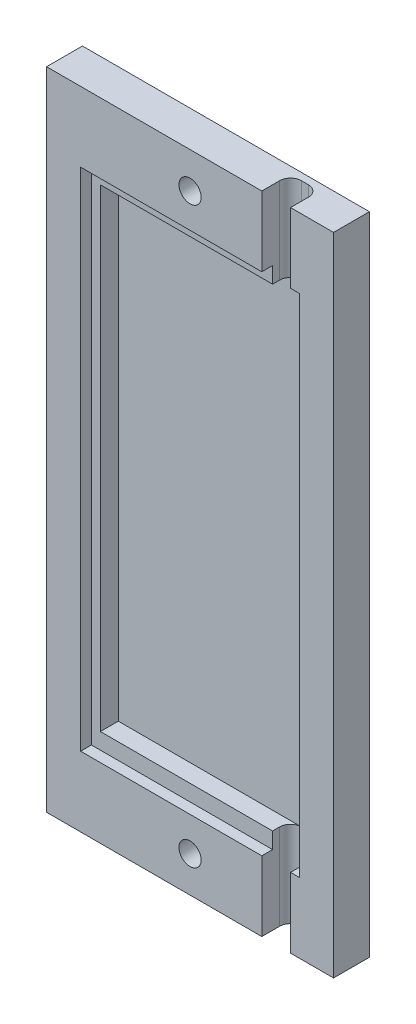
from build123d import *

# Parameters (mm, degrees)
SKETCH1_W           = 90
SKETCH1_H           = 40
BOSS_EXTRUDE1_DEPTH = 5
SKETCH2_W           = 30.5
SKETCH2_H           = 70.5
CUT_EXTRUDE1_DEPTH  = 1.5
SKETCH3_W           = 28
SKETCH3_H           = 66
CUT_EXTRUDE2_DEPTH  = 2.5
SKETCH4_W           = 4
SKETCH4_H           = 4
CUT_EXTRUDE3_DEPTH  = 99.615414617
FILLET1_R           = 1.5
SKETCH6_R           = 1.55
CUT_EXTRUDE5_DEPTH  = 4.5
SKETCH7_R           = 1.55
CUT_EXTRUDE6_DEPTH  = 4.5


with BuildPart() as part:
    # Sketch1 → Boss-Extrude1 (new body)
    with BuildSketch(Plane(origin=(0, 0, 0), x_dir=(0, 1, 0), z_dir=(0, 0, 1))):
        with Locations((45, 20)):
            Rectangle(SKETCH1_W, SKETCH1_H)
    extrude(amount=BOSS_EXTRUDE1_DEPTH)

    # Sketch2 → Cut-Extrude1 (cut)
    with BuildSketch(Plane.XY.offset(5)):
        with Locations((-20, 45)):
            Rectangle(SKETCH2_W, SKETCH2_H)
    extrude(amount=-CUT_EXTRUDE1_DEPTH, mode=Mode.SUBTRACT)

    # Sketch3 → Cut-Extrude2 (cut)
    with BuildSketch(Plane.XY.offset(3.5)):
        with Locations((-20, 45)):
            Rectangle(SKETCH3_W, SKETCH3_H)
    extrude(amount=-CUT_EXTRUDE2_DEPTH, mode=Mode.SUBTRACT)

    # Sketch4 → Cut-Extrude3 (cut, through all)
    with BuildSketch(Plane.XZ):
        with Locations((-8, 3)):
            Rectangle(SKETCH4_W, SKETCH4_H)
    extrude(amount=-CUT_EXTRUDE3_DEPTH, mode=Mode.SUBTRACT)

    # Fillet1
    fillet1_edges = [part.edges().sort_by_distance(p)[0] for p in [
        (-6, 45, 1),
        (-10, 84, 1),
        (-10, 6, 1),
    ]]
    fillet(fillet1_edges, radius=FILLET1_R)

    # Sketch6 → Cut-Extrude5 (cut)
    with BuildSketch(Plane.XY.offset(5)):
        with Locations((-20, 85)):
            Circle(SKETCH6_R)
    extrude(amount=-CUT_EXTRUDE5_DEPTH, mode=Mode.SUBTRACT)

    # Sketch7 → Cut-Extrude6 (cut)
    with BuildSketch(Plane.XY.offset(5)):
        with Locations((-20, 5)):
            Circle(SKETCH7_R)
    extrude(amount=-CUT_EXTRUDE6_DEPTH, mode=Mode.SUBTRACT)


solid = part.part
